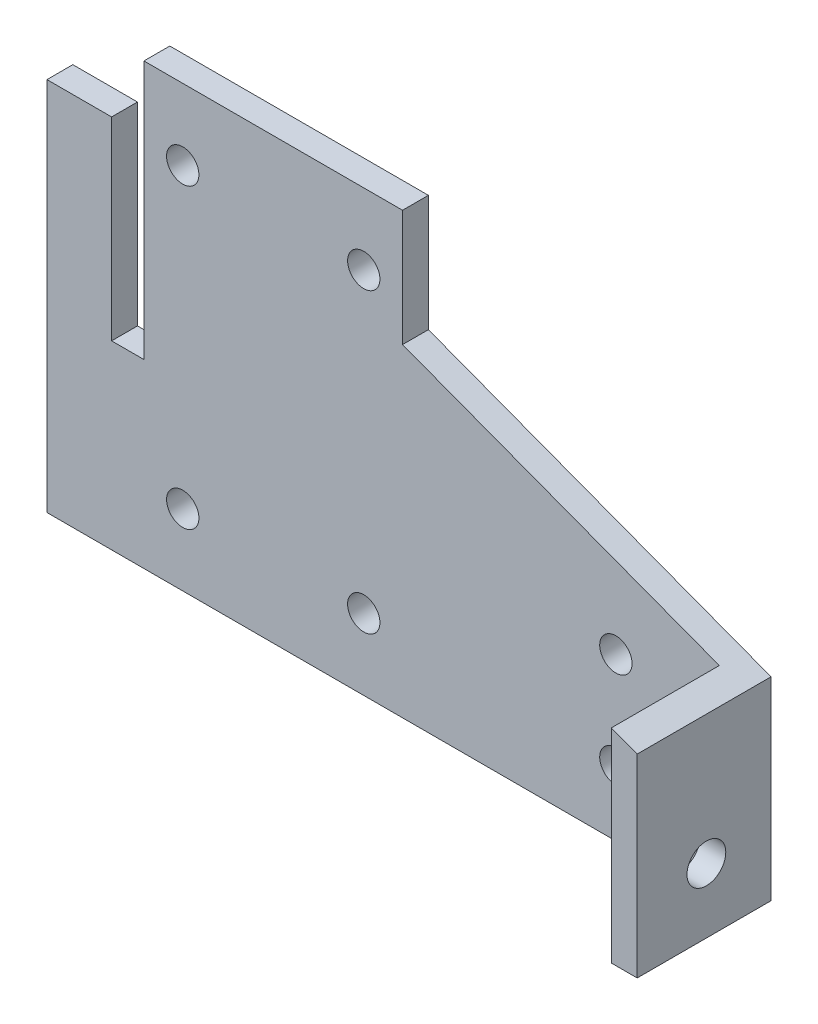
from build123d import *

# Parameters (mm, degrees)
SKETCH_1_R          = 2.5
EXTRUDE_1_DEPTH     = 4
EXTRUDE_2_DEPTH     = 16.7
SKETCH_3_R          = 3
CUT_EXTRUDE_1_DEPTH = 10
CUT_EXTRUDE_2_DEPTH = 10


with BuildPart() as part:
    # Эскиз1 → Бобышка-Вытянуть1 (new body)
    with BuildSketch(Plane.XY):
        Polygon((0, 0), (108, 0), (108, 30), (55, 50), (55, 68), (0, 68), align=None)
        with Locations((21, 57)):
            Circle(SKETCH_1_R, mode=Mode.SUBTRACT)
        with Locations((49, 57)):
            Circle(SKETCH_1_R, mode=Mode.SUBTRACT)
        with Locations((21, 11)):
            Circle(SKETCH_1_R, mode=Mode.SUBTRACT)
        with Locations((49, 11)):
            Circle(SKETCH_1_R, mode=Mode.SUBTRACT)
        with Locations((88, 10)):
            Circle(SKETCH_1_R, mode=Mode.SUBTRACT)
        with Locations((88, 25)):
            Circle(SKETCH_1_R, mode=Mode.SUBTRACT)
    extrude(amount=EXTRUDE_1_DEPTH)

    # Эскиз2 → Бобышка-Вытянуть2 (add)
    with BuildSketch(Plane.XY.offset(4)):
        Polygon((108, 0), (104, 0), (104, 31.509433962), (108, 30), align=None)
    extrude(amount=EXTRUDE_2_DEPTH)

    # Эскиз3 → Вырез-Вытянуть1 (cut)
    with BuildSketch(Plane(origin=(108, 0, 0), x_dir=(0, 0, -1), z_dir=(1, 0, 0))):
        with Locations((-10, 10)):
            Circle(SKETCH_3_R)
    extrude(amount=-CUT_EXTRUDE_1_DEPTH, mode=Mode.SUBTRACT)

    # Эскиз4 → Вырез-Вытянуть2 (cut)
    with BuildSketch(Plane.XY.offset(4)):
        Polygon((0, 68), (15, 68), (15, 58), (15, 28), (10, 28), (10, 58), (0, 58), align=None)
    extrude(amount=-CUT_EXTRUDE_2_DEPTH, mode=Mode.SUBTRACT)


solid = part.part
